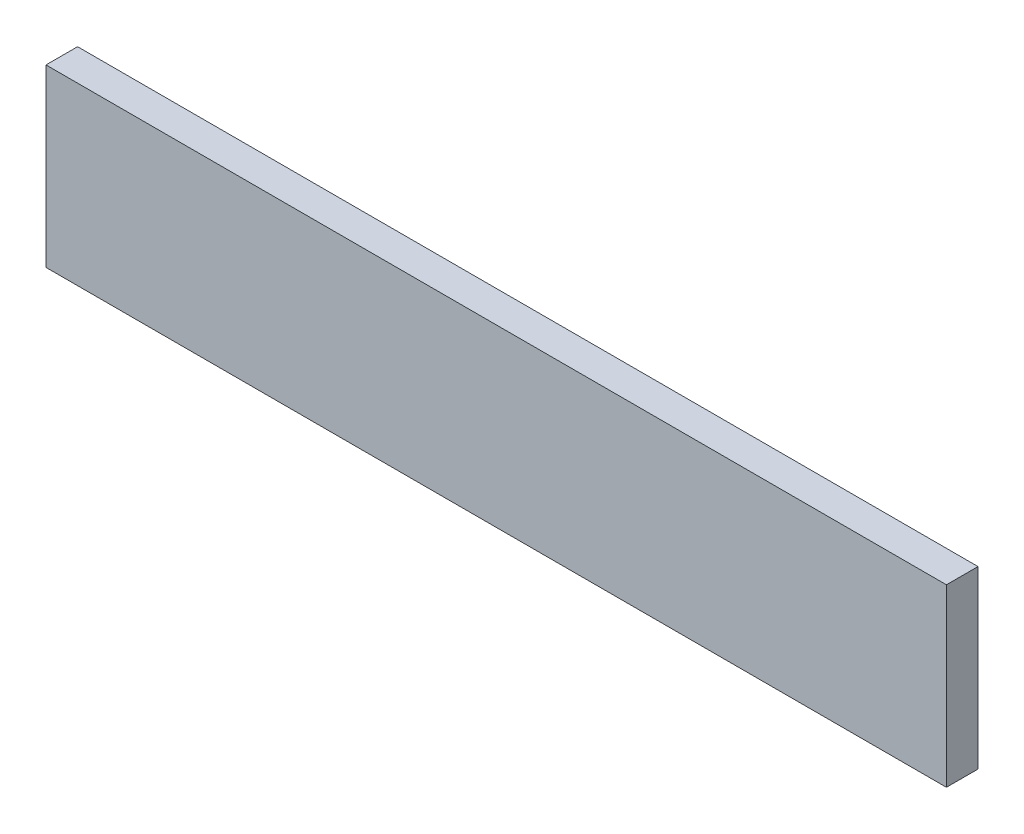
from build123d import *

# Parameters (mm, degrees)
ESQUISSE1_W        = 770
ESQUISSE1_H        = 150
BOSS_EXTRU_1_DEPTH = 27


with BuildPart() as part:
    # Esquisse1 → Boss.-Extru.1 (new body)
    with BuildSketch(Plane.XY):
        with Locations((385, 75)):
            Rectangle(ESQUISSE1_W, ESQUISSE1_H)
    extrude(amount=BOSS_EXTRU_1_DEPTH)


solid = part.part
